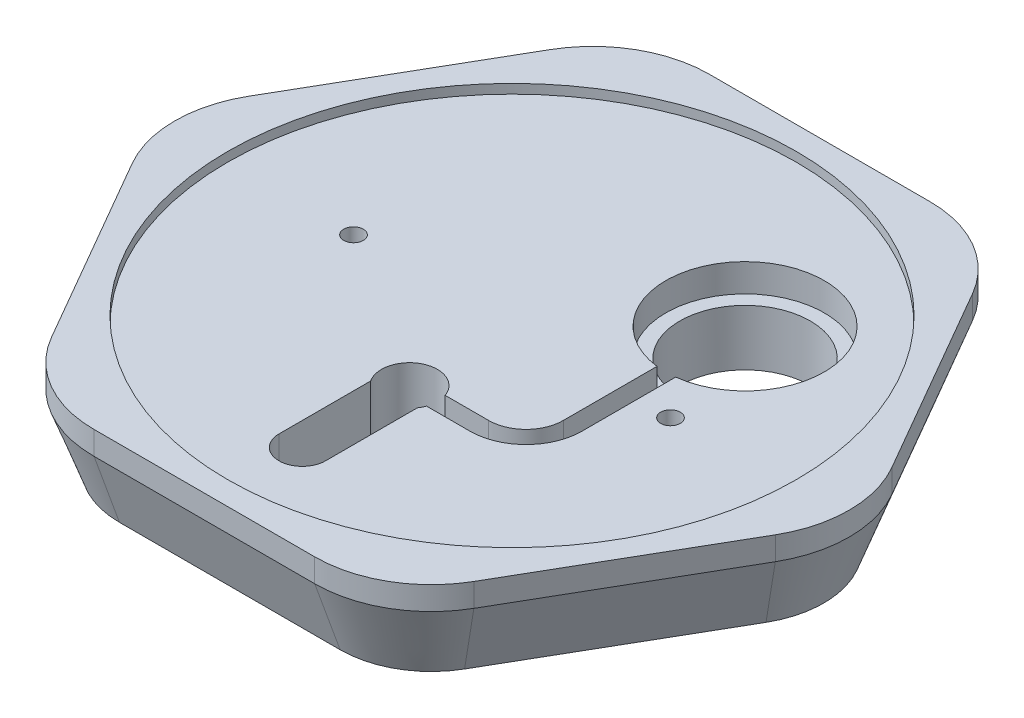
from build123d import *

# Parameters (mm, degrees)
BOSS_EXTRUDE1_DEPTH = 5
BOSS_EXTRUDE2_DEPTH = 15
BOSS_EXTRUDE2_TAPER = 20
SKETCH3_R           = 61
CUT_EXTRUDE1_DEPTH  = 2
SKETCH4_R           = 17
CUT_EXTRUDE2_DEPTH  = 6
CUT_EXTRUDE3_REACH  = 100.658
SKETCH7_R           = 14
SKETCH8_R           = 12.75
CUT_EXTRUDE4_DEPTH  = 16
SKETCH9_R           = 2.1
CUT_EXTRUDE5_DEPTH  = 20
SKETCH12_R          = 4.1
CUT_EXTRUDE7_DEPTH  = 60
SKETCH13_R          = 7.1
CUT_EXTRUDE8_DEPTH  = 18
SKETCH14_W          = 14.5
SKETCH14_H          = 7
CUT_EXTRUDE9_DEPTH  = 16
CUT_EXTRUDE10_START = -5
SKETCH15_R          = 2.1
CUT_EXTRUDE10_DEPTH = 5
CUT_EXTRUDE11_REACH = 101.566
SKETCH16_R          = 6
CUT_EXTRUDE12_DEPTH = 12
CUT_EXTRUDE13_DEPTH = 10


with BuildPart() as part:
    # Sketch1 → Boss-Extrude1 (new body)
    with BuildSketch(Plane(origin=(0, 0, 0), x_dir=(1, 0, 0), z_dir=(0, 1, 0))):
        with BuildLine():
            Line((68.993357168, 12.5), (45.321996131, 53.5))
            ThreePointArc((45.321996131, 53.5), (36.171361037, 62.650635095), (23.671361037, 66))
            Line((23.671361037, 66), (-23.671361037, 66))
            ThreePointArc((-23.671361037, 66), (-36.171361037, 62.650635095), (-45.321996131, 53.5))
            Line((-45.321996131, 53.5), (-68.993357168, 12.5))
            ThreePointArc((-68.993357168, 12.5), (-72.342722074, 0), (-68.993357168, -12.5))
            Line((-68.993357168, -12.5), (-45.321996131, -53.5))
            ThreePointArc((-45.321996131, -53.5), (-36.171361037, -62.650635095), (-23.671361037, -66))
            Line((-23.671361037, -66), (23.671361037, -66))
            ThreePointArc((23.671361037, -66), (36.171361037, -62.650635095), (45.321996131, -53.5))
            Line((45.321996131, -53.5), (68.993357168, -12.5))
            ThreePointArc((68.993357168, -12.5), (72.342722074, 0), (68.993357168, 12.5))
        make_face()
    extrude(amount=BOSS_EXTRUDE1_DEPTH)

    # Sketch2 → Boss-Extrude2 (add)
    with BuildSketch(Plane.XZ):
        with BuildLine():
            Line((-68.993357168, -12.5), (-45.321996131, -53.5))
            ThreePointArc((-45.321996131, -53.5), (-36.171361037, -62.650635095), (-23.671361037, -66))
            Line((-23.671361037, -66), (23.671361037, -66))
            ThreePointArc((23.671361037, -66), (36.171361037, -62.650635095), (45.321996131, -53.5))
            Line((45.321996131, -53.5), (68.993357168, -12.5))
            ThreePointArc((68.993357168, -12.5), (72.342722074, 0), (68.993357168, 12.5))
            Line((68.993357168, 12.5), (45.321996131, 53.5))
            ThreePointArc((45.321996131, 53.5), (36.171361037, 62.650635095), (23.671361037, 66))
            Line((23.671361037, 66), (-23.671361037, 66))
            ThreePointArc((-23.671361037, 66), (-36.171361037, 62.650635095), (-45.321996131, 53.5))
            Line((-45.321996131, 53.5), (-68.993357168, 12.5))
            ThreePointArc((-68.993357168, 12.5), (-72.342722074, 0), (-68.993357168, -12.5))
        make_face()
    extrude(amount=BOSS_EXTRUDE2_DEPTH, taper=BOSS_EXTRUDE2_TAPER)

    # Sketch3 → Cut-Extrude1 (cut)
    with BuildSketch(Plane(origin=(0, 5, 0), x_dir=(1, 0, 0), z_dir=(0, 1, 0))):
        with Locations(Location((0, 0, 0), (0, 0, 270))):
            Circle(SKETCH3_R)
    extrude(amount=-CUT_EXTRUDE1_DEPTH, mode=Mode.SUBTRACT)

    # Sketch4 → Cut-Extrude2 (cut)
    with BuildSketch(Plane(origin=(0, 3, 0), x_dir=(1, 0, 0), z_dir=(0, 1, 0))):
        with Locations(Location((25, 25, 0), (0, 0, 270))):
            Circle(SKETCH4_R)
    extrude(amount=-CUT_EXTRUDE2_DEPTH, mode=Mode.SUBTRACT)

    # Sketch7 → Cut-Extrude3 (cut, up to next)
    with BuildSketch(Plane(origin=(0, -3, 0), x_dir=(1, 0, 0), z_dir=(0, 1, 0)), mode=Mode.PRIVATE) as cut_extrude3_sk1:
        with Locations(Location((25, 25, 0), (0, 0, 270))):
            Circle(SKETCH7_R)
    cut_extrude3_tool1 = extrude(cut_extrude3_sk1.sketch, amount=-CUT_EXTRUDE3_REACH, mode=Mode.PRIVATE) & part.part
    add(cut_extrude3_tool1.solids().sort_by_distance((25, -3, -25))[0], mode=Mode.SUBTRACT)

    # Sketch8 → Cut-Extrude4 (cut)
    with BuildSketch(Plane(origin=(0, -15, 0), x_dir=(-1, 0, 0), z_dir=(0, -1, 0))):
        with Locations(Location((0, 0, 0), (0, 0, 90))):
            Circle(SKETCH8_R)
    extrude(amount=-CUT_EXTRUDE4_DEPTH, mode=Mode.SUBTRACT)

    # Sketch9 → Cut-Extrude5 (cut)
    with BuildSketch(Plane(origin=(0, 3, 0), x_dir=(1, 0, 0), z_dir=(0, 1, 0))):
        with Locations(Location((34, 0, 0), (0, 0, 270))):
            Circle(SKETCH9_R)
        with Locations(Location((-34, 0, 0), (0, 0, 270))):
            Circle(SKETCH9_R)
    extrude(amount=-CUT_EXTRUDE5_DEPTH, mode=Mode.SUBTRACT)

    # Sketch12 → Cut-Extrude7 (cut)
    with BuildSketch(Plane(origin=(0, 0, -66), x_dir=(-1, 0, 0), z_dir=(0, 0, -1))):
        with Locations(Location((0, -7, 0), (0, 0, 90))):
            Circle(SKETCH12_R)
    extrude(amount=-CUT_EXTRUDE7_DEPTH, mode=Mode.SUBTRACT)

    # Sketch13 → Cut-Extrude8 (cut)
    with BuildSketch(Plane(origin=(0, 0, -66), x_dir=(-1, 0, 0), z_dir=(0, 0, -1))):
        with Locations((0, -7)):
            Circle(SKETCH13_R)
    extrude(amount=-CUT_EXTRUDE8_DEPTH, mode=Mode.SUBTRACT)

    # Sketch14 → Cut-Extrude9 (cut)
    with BuildSketch(Plane(origin=(0, -15, 0), x_dir=(-1, 0, 0), z_dir=(0, -1, 0))):
        with Locations((0, 25)):
            Rectangle(SKETCH14_W, SKETCH14_H)
    extrude(amount=-CUT_EXTRUDE9_DEPTH, mode=Mode.SUBTRACT)

    # Sketch15 → Cut-Extrude10 (cut)
    # profile 1 of 2: a face of its own
    with BuildSketch(Plane.XZ.offset(15).offset(CUT_EXTRUDE10_START)):
        Polygon((-34, 4.156921938), (-37.6, 2.078460969), (-37.6, -2.078460969), (-34, -4.156921938), (-30.4, -2.078460969), (-30.4, 2.078460969), align=None)
        with Locations(Location((-34, 0, 0), (0, 0, 90))):
            Circle(SKETCH15_R, mode=Mode.SUBTRACT)
    # profile 2 of 2: a face of its own
    with BuildSketch(Plane.XZ.offset(15).offset(CUT_EXTRUDE10_START)):
        Polygon((34, 4.156921938), (30.4, 2.078460969), (30.4, -2.078460969), (34, -4.156921938), (37.6, -2.078460969), (37.6, 2.078460969), align=None)
        with Locations(Location((34, 0, 0), (0, 0, 90))):
            Circle(SKETCH15_R, mode=Mode.SUBTRACT)
    extrude(amount=CUT_EXTRUDE10_DEPTH, mode=Mode.SUBTRACT)

    # Sketch16 → Cut-Extrude11 (cut, up to next)
    with BuildSketch(Plane(origin=(0, 3, 0), x_dir=(1, 0, 0), z_dir=(0, 1, 0)), mode=Mode.PRIVATE) as cut_extrude11_sk1:
        with Locations(Location((0, -22, 0), (0, 0, 270))):
            Circle(SKETCH16_R)
    cut_extrude11_tool1 = extrude(cut_extrude11_sk1.sketch, amount=-CUT_EXTRUDE11_REACH, mode=Mode.PRIVATE) & part.part
    add(cut_extrude11_tool1.solids().sort_by_distance((0, 3, 22))[0], mode=Mode.SUBTRACT)

    # Sketch17 → Cut-Extrude12 (cut)
    with BuildSketch(Plane(origin=(0, 3, 0), x_dir=(1, 0, 0), z_dir=(0, 1, 0))):
        with BuildLine():
            Line((25, -12), (25, 8))
            ThreePointArc((25, 8), (23.998259334, 8.029539911), (23, 8.118056984))
            Line((23, 8.118056984), (23, -12))
            ThreePointArc((23, -12), (20.656854249, -17.656854249), (15, -20))
            Line((15, -20), (5.656854249, -20))
            ThreePointArc((5.656854249, -20), (5.913591358, -20.985388128), (6, -22))
            Line((6, -22), (15, -22))
            ThreePointArc((15, -22), (22.071067812, -19.071067812), (25, -12))
        make_face()
        with BuildLine():
            ThreePointArc((27, 8.118056984), (26.001740666, 8.029539911), (25, 8))
            Line((25, 8), (25, -12))
            ThreePointArc((25, -12), (22.071067812, -19.071067812), (15, -22))
            Line((15, -22), (6, -22))
            ThreePointArc((6, -22), (5.913591358, -23.014611872), (5.656854249, -24))
            Line((5.656854249, -24), (15, -24))
            ThreePointArc((15, -24), (23.485281374, -20.485281374), (27, -12))
            Line((27, -12), (27, 8.118056984))
        make_face()
        with BuildLine():
            Line((25, 8), (25, 25))
            Line((25, 25), (23, 25))
            Line((23, 25), (23, 8.118056984))
            ThreePointArc((23, 8.118056984), (23.998259334, 8.029539911), (25, 8))
        make_face()
        with BuildLine():
            Line((27, 25), (25, 25))
            Line((25, 25), (25, 8))
            ThreePointArc((25, 8), (26.001740666, 8.029539911), (27, 8.118056984))
            Line((27, 8.118056984), (27, 25))
        make_face()
    extrude(amount=-CUT_EXTRUDE12_DEPTH, mode=Mode.SUBTRACT)

    # Sketch18 → Cut-Extrude13 (cut)
    with BuildSketch(Plane(origin=(0, 3, 0), x_dir=(1, 0, 0), z_dir=(0, 1, 0))):
        with BuildLine():
            Line((5, -25), (5, -45))
            ThreePointArc((5, -45), (0, -50), (-5, -45))
            Line((-5, -45), (-5, -25))
            ThreePointArc((-5, -25), (0, -20), (5, -25))
        make_face()
    extrude(amount=-CUT_EXTRUDE13_DEPTH, mode=Mode.SUBTRACT)


solid = part.part
